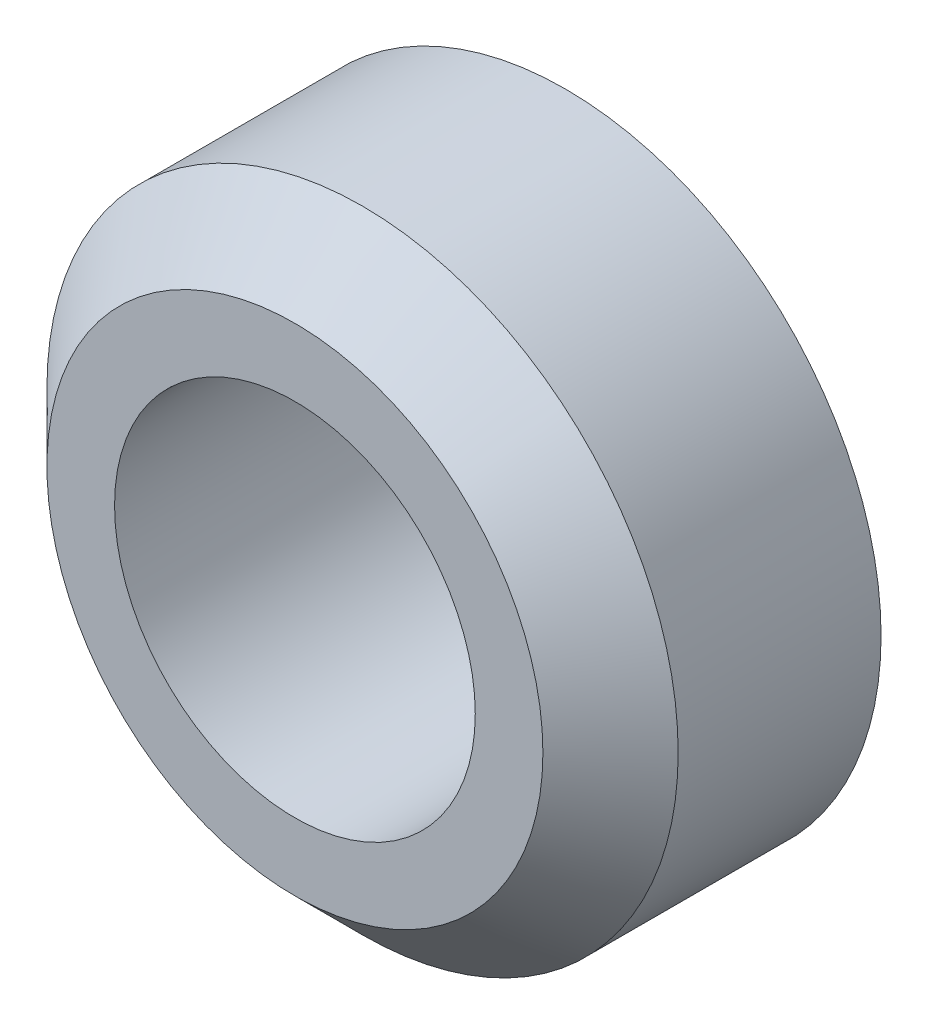
from build123d import *

# Parameters (mm, degrees)
SCHIZZO1_R                   = 7
SCHIZZO1_R_2                 = 4
ESTRUSIONE_ESTRUSIONE1_DEPTH = 6
SMUSSO1_SIZE                 = 1.5


with BuildPart() as part:
    # Schizzo1 → Estrusione-Estrusione1 (new body)
    with BuildSketch(Plane.XY):
        Circle(SCHIZZO1_R)
        Circle(SCHIZZO1_R_2, mode=Mode.SUBTRACT)
    extrude(amount=ESTRUSIONE_ESTRUSIONE1_DEPTH)

    # Smusso1
    smusso1_edges = [part.edges().sort_by_distance(p)[0] for p in [
        (-7, 0, 6),
    ]]
    chamfer(smusso1_edges, length=SMUSSO1_SIZE)


solid = part.part
